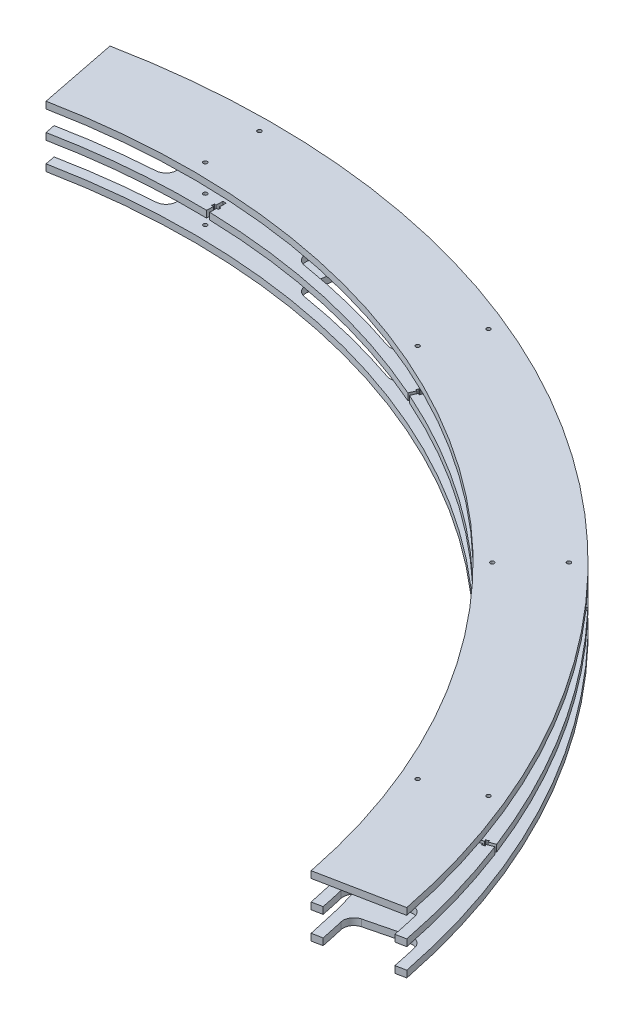
from build123d import *

# Parameters (mm, degrees)
SKETCH1_R                  = 712.819772368
SKETCH1_R_2                = 636.619772368
TRACKTOP_DEPTH             = 6.35
SKETCH11_R                 = 712.819772368
SKETCH11_R_2               = 636.619772368
INTERNAL_DEPTH             = 6.35
SKETCH13_R                 = 712.819772368
SKETCH13_R_2               = 636.619772368
TRACKBOTTOM_DEPTH          = 6.35
SKETCH6_R                  = 1.8288
MOUNTINGHOLES_DEPTH        = 1010.358556587
CIRPATTERN3_COUNT          = 16
CUTOUT_START               = -1009.5792573
SKETCH12_R                 = 20.6375
CUTOUT_DEPTH               = 1015.9292573
CIRPATTERN4_COUNT          = 16
TEENUTSLOTS_DEPTH          = 6.35
CIRPATTERN5_COUNT          = 16
CUTINTOQUARTERS_DEPTH      = 1010.358556587
CUTINTOQUARTERS_DEPTH_BACK = 1010.358556587


with BuildPart() as part:
    # Sketch1 → TrackTop (new body)
    with BuildSketch(Plane(origin=(0, 0, 0), x_dir=(1, 0, 0), z_dir=(0, 1, 0))):
        with Locations(Location((0, 0, 0), (0, 0, 270))):
            Circle(SKETCH1_R)
        with Locations(Location((0, 0, 0), (0, 0, 270))):
            Circle(SKETCH1_R_2, mode=Mode.SUBTRACT)
    extrude(amount=TRACKTOP_DEPTH)


with BuildPart() as body_2:
    # Sketch11 → Internal (new body)
    with BuildSketch(Plane(origin=(0, -25.4, 0), x_dir=(1, 0, 0), z_dir=(0, 1, 0))):
        with Locations(Location((0, 0, 0), (0, 0, 270))):
            Circle(SKETCH11_R)
        with Locations(Location((0, 0, 0), (0, 0, 270))):
            Circle(SKETCH11_R_2, mode=Mode.SUBTRACT)
    extrude(amount=INTERNAL_DEPTH)


with BuildPart() as body_3:
    # Sketch13 → TrackBottom (new body)
    with BuildSketch(Plane(origin=(0, -50.8, 0), x_dir=(1, 0, 0), z_dir=(0, 1, 0))):
        with Locations(Location((0, 0, 0), (0, 0, 270))):
            Circle(SKETCH13_R)
        with Locations(Location((0, 0, 0), (0, 0, 270))):
            Circle(SKETCH13_R_2, mode=Mode.SUBTRACT)
    extrude(amount=TRACKBOTTOM_DEPTH)


with BuildPart() as mountingholes_tool:
    # Sketch6 → MountingHoles (new, symmetric)
    with BuildSketch(Plane(origin=(0, 0, 0), x_dir=(1, 0, 0), z_dir=(0, 1, 0))):
        with Locations(Location((649.319772368, 0, 0), (0, 0, 270))):
            Circle(SKETCH6_R)
        with Locations(Location((700.119772368, 0, 0), (0, 0, 270))):
            Circle(SKETCH6_R)
    mountingholes = extrude(amount=MOUNTINGHOLES_DEPTH, both=True)


with BuildPart() as part_1:
    add(part.part)

    # MountingHoles: cut by mountingholes_tool
    add(mountingholes_tool.part, mode=Mode.SUBTRACT)


with BuildPart() as body_2_1:
    add(body_2.part)

    # MountingHoles: cut by mountingholes_tool
    add(mountingholes_tool.part, mode=Mode.SUBTRACT)


with BuildPart() as body_3_1:
    add(body_3.part)

    # MountingHoles: cut by mountingholes_tool
    add(mountingholes_tool.part, mode=Mode.SUBTRACT)


with BuildPart() as cirpattern3_tool:
    # CirPattern3: MountingHoles ×16 about axis
    cirpattern3_axis = Axis((0, 0, 0), (0, 1, 0))
    for i in range(1, CIRPATTERN3_COUNT):
        add(mountingholes.rotate(cirpattern3_axis, i * 360 / CIRPATTERN3_COUNT))


with BuildPart() as part_2:
    add(part_1.part)

    # CirPattern3: cut by cirpattern3_tool
    add(cirpattern3_tool.part, mode=Mode.SUBTRACT)


with BuildPart() as body_2_2:
    add(body_2_1.part)

    # CirPattern3: cut by cirpattern3_tool
    add(cirpattern3_tool.part, mode=Mode.SUBTRACT)


with BuildPart() as body_3_2:
    add(body_3_1.part)

    # CirPattern3: cut by cirpattern3_tool
    add(cirpattern3_tool.part, mode=Mode.SUBTRACT)


with BuildPart() as cutout_tool:
    # Sketch12 → Cutout (new body)
    with BuildSketch(Plane(origin=(0, -25.4, 0), x_dir=(1, 0, 0), z_dir=(0, 1, 0)).offset(CUTOUT_START)):
        with Locations(Location((640.665437866, 211.647272478, 0), (0, 0, 270))):
            Circle(SKETCH12_R)
        with BuildLine():
            Line((626.665852646, 296.390874555), (593.078958538, 280.505456711))
            ThreePointArc((593.078958538, 280.505456711), (585.506357169, 280.10450972), (579.829726301, 285.132522445))
            ThreePointArc((579.829726301, 285.132522445), (554.216857462, 332.18480062), (524.794275595, 376.953624682))
            ThreePointArc((524.794275595, 376.953624682), (523.035909523, 384.330154946), (526.959212774, 390.819588017))
            Line((526.959212774, 390.819588017), (556.801652847, 412.952249999))
            ThreePointArc((556.801652847, 412.952249999), (564.297253143, 414.801100133), (570.875808581, 410.760694342))
            ThreePointArc((570.875808581, 410.760694342), (603.236047523, 361.565772451), (631.367584197, 309.83626396))
            ThreePointArc((631.367584197, 309.83626396), (631.829794414, 302.129861925), (626.665852646, 296.390874555))
        make_face()
    cutout = extrude(amount=CUTOUT_DEPTH)


with BuildPart() as body_2_3:
    add(body_2_2.part)

    # Cutout: cut by cutout_tool
    add(cutout_tool.part, mode=Mode.SUBTRACT)


with BuildPart() as body_3_3:
    add(body_3_2.part)

    # Cutout: cut by cutout_tool
    add(cutout_tool.part, mode=Mode.SUBTRACT)


with BuildPart() as cirpattern4_tool:
    # CirPattern4: Cutout ×16 about axis
    cirpattern4_axis = Axis((0, 0, 0), (0, 1, 0))
    for i in range(1, CIRPATTERN4_COUNT):
        add(cutout.rotate(cirpattern4_axis, i * 360 / CIRPATTERN4_COUNT))


with BuildPart() as body_2_4:
    add(body_2_3.part)

    # CirPattern4: cut by cirpattern4_tool
    add(cirpattern4_tool.part, mode=Mode.SUBTRACT)

    # Sketch9 → TeeNutSlots (cut)
    with BuildSketch(Plane(origin=(0, -25.4, 0), x_dir=(1, 0, 0), z_dir=(0, 1, 0))):
        with BuildLine():
            Line((598.831772587, 234.129977151), (599.335985533, 232.82285424))
            Line((599.335985533, 232.82285424), (593.411481261, 230.537520758))
            ThreePointArc((593.411481261, 230.537520758), (593.961663215, 229.116296235), (594.508441332, 227.693758707))
            Line((594.508441332, 227.693758707), (600.432945605, 229.979092189))
            Line((600.432945605, 229.979092189), (600.937158551, 228.671969278))
            ThreePointArc((600.937158551, 228.671969278), (600.925821981, 228.21016864), (601.26038051, 228.528694838))
            Line((601.26038051, 228.528694838), (603.015573212, 229.205747375))
            ThreePointArc((603.015573212, 229.205747375), (603.477373851, 229.194410806), (603.158847653, 229.528969334))
            Line((603.158847653, 229.528969334), (602.654634707, 230.836092245))
            Line((602.654634707, 230.836092245), (608.579138979, 233.121425727))
            Line((608.579138979, 233.121425727), (607.482178908, 235.965187778))
            Line((607.482178908, 235.965187778), (601.557674636, 233.679854296))
            Line((601.557674636, 233.679854296), (601.053461689, 234.986977207))
            ThreePointArc((601.053461689, 234.986977207), (601.064798259, 235.448777846), (600.730239731, 235.130251648))
            Line((600.730239731, 235.130251648), (598.975047028, 234.45319911))
            ThreePointArc((598.975047028, 234.45319911), (598.513246389, 234.46453568), (598.831772587, 234.129977151))
        make_face()
        with BuildLine():
            Line((664.505714466, 257.961592722), (658.581210194, 255.67625924))
            Line((658.581210194, 255.67625924), (658.076997248, 256.983382151))
            ThreePointArc((658.076997248, 256.983382151), (658.088333817, 257.44518279), (657.753775289, 257.126656592))
            Line((657.753775289, 257.126656592), (655.998582586, 256.449604054))
            ThreePointArc((655.998582586, 256.449604054), (655.536781947, 256.460940624), (655.855308145, 256.126382095))
            Line((655.855308145, 256.126382095), (656.359521092, 254.819259184))
            Line((656.359521092, 254.819259184), (650.435016819, 252.533925702))
            Line((650.435016819, 252.533925702), (651.53197689, 249.690163651))
            Line((651.53197689, 249.690163651), (657.456481163, 251.975497133))
            Line((657.456481163, 251.975497133), (657.960694109, 250.668374222))
            ThreePointArc((657.960694109, 250.668374222), (657.94935754, 250.206573584), (658.283916068, 250.525099782))
            Line((658.283916068, 250.525099782), (660.039108771, 251.202152319))
            ThreePointArc((660.039108771, 251.202152319), (660.500909409, 251.19081575), (660.182383211, 251.525374278))
            Line((660.182383211, 251.525374278), (659.678170265, 252.832497189))
            Line((659.678170265, 252.832497189), (665.602674538, 255.117830671))
            ThreePointArc((665.602674538, 255.117830671), (665.055714486, 256.540298019), (664.505714466, 257.961592722))
        make_face()
    teenutslots = extrude(amount=TEENUTSLOTS_DEPTH, mode=Mode.SUBTRACT)

    # CirPattern5: TeeNutSlots ×16 about axis
    cirpattern5_axis = Axis((0, 0, 0), (0, 1, 0))
    for i in range(1, CIRPATTERN5_COUNT):
        add(teenutslots.rotate(cirpattern5_axis, i * 360 / CIRPATTERN5_COUNT), mode=Mode.SUBTRACT)


with BuildPart() as body_3_4:
    add(body_3_3.part)

    # CirPattern4: cut by cirpattern4_tool
    add(cirpattern4_tool.part, mode=Mode.SUBTRACT)


with BuildPart() as cutintoquarters_tool:
    # Sketch4 → CutIntoQuarters (new, two sides: drawn at the far end of the back side and taken through both)
    with BuildSketch(Plane(origin=(0, 0, 0), x_dir=(1, 0, 0), z_dir=(0, 1, 0)).offset(-CUTINTOQUARTERS_DEPTH_BACK)):
        Polygon((0, 0), (-203.168306649, 1021.396051563), (-1224.564358211, 818.227744914), (-818.227744914, -1224.564358211), (1224.564358211, -818.227744914), (1021.396051563, 203.168306649), align=None)
    extrude(amount=CUTINTOQUARTERS_DEPTH + CUTINTOQUARTERS_DEPTH_BACK)


with BuildPart() as part_3:
    add(part_2.part)

    # CutIntoQuarters: cut by cutintoquarters_tool
    add(cutintoquarters_tool.part, mode=Mode.SUBTRACT)


with BuildPart() as body_2_5:
    add(body_2_4.part)

    # CutIntoQuarters: cut by cutintoquarters_tool
    add(cutintoquarters_tool.part, mode=Mode.SUBTRACT)


with BuildPart() as body_3_5:
    add(body_3_4.part)

    # CutIntoQuarters: cut by cutintoquarters_tool
    add(cutintoquarters_tool.part, mode=Mode.SUBTRACT)


solid = Compound([part_3.part, body_2_5.part, body_3_5.part])
